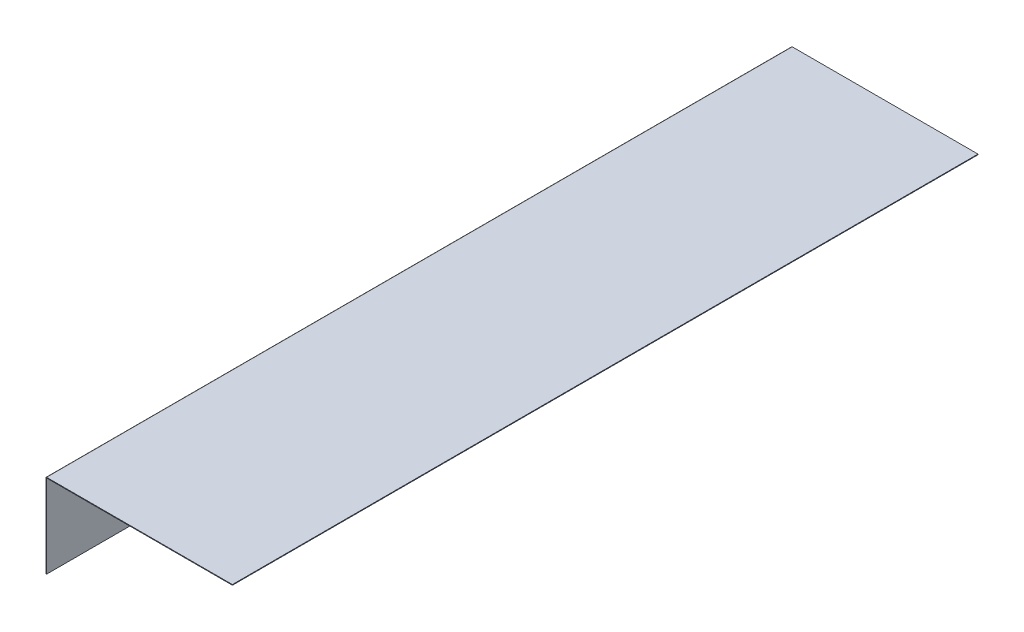
from build123d import *

# Parameters (mm, degrees)
BOSS_EXTRUDE1_DEPTH = 1200
FILLET1_R           = 1


with BuildPart() as part:
    # Sketch1 → Boss-Extrude1 (new body)
    with BuildSketch(Plane.XY):
        Polygon((0, 0), (0, 135), (300, 135), (300, 134), (1, 134), (1, 0), align=None)
    extrude(amount=BOSS_EXTRUDE1_DEPTH)

    # Fillet1
    fillet1_edges = [part.edges().sort_by_distance(p)[0] for p in [
        (0, 135, 600),
        (1, 134, 600),
    ]]
    fillet(fillet1_edges, radius=FILLET1_R)


solid = part.part
